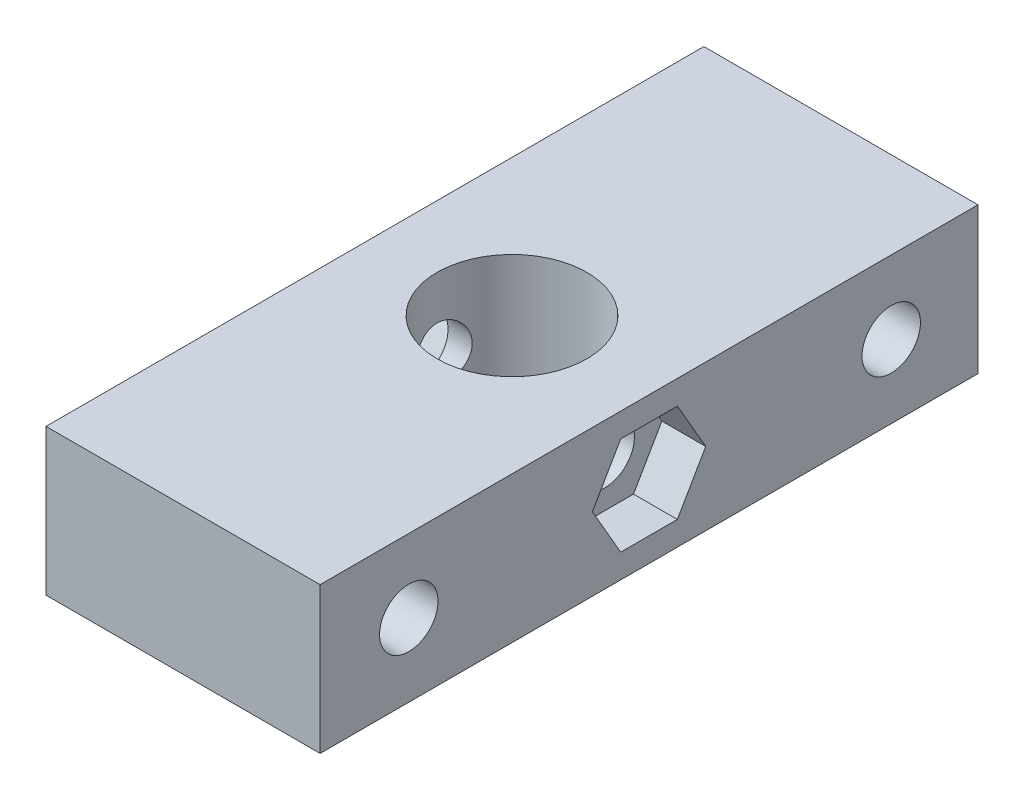
from build123d import *

# Parameters (mm, degrees)
SKETCH2_W                = 15
SKETCH2_H                = 36
BOSS_EXTRUDE1_DEPTH      = 8
SKETCH4_R                = 4.1
CUT_EXTRUDE1_DEPTH       = 22.077238908
CUT_EXTRUDE2_DEPTH       = 2.4
CUT_EXTRUDE5_DEPTH       = 2.4
CUT_EXTRUDE8_DEPTH       = 2.4
CUT_EXTRUDE9_REACH       = 25.383
CUT_EXTRUDE9_END_RADIUS  = 4.1
SKETCH21_R               = 1.6
CUT_EXTRUDE10_REACH      = 25.383
CUT_EXTRUDE10_END_RADIUS = 4.1
SKETCH16_R               = 1.6
SKETCH24_R               = 1.6
CUT_EXTRUDE11_DEPTH      = 24.382899769


with BuildPart() as part:
    # Sketch2 → Boss-Extrude1 (new body)
    with BuildSketch(Plane(origin=(0, 0, 0), x_dir=(1, 0, 0), z_dir=(0, 1, 0))):
        Rectangle(SKETCH2_W, SKETCH2_H)
    extrude(amount=BOSS_EXTRUDE1_DEPTH)

    # Sketch4 → Cut-Extrude1 (cut, through all)
    with BuildSketch(Plane(origin=(0, 8, 0), x_dir=(1, 0, 0), z_dir=(0, 1, 0))):
        with Locations(Location((0, 0, 0), (0, 0, 270))):
            Circle(SKETCH4_R)
    extrude(amount=-CUT_EXTRUDE1_DEPTH, mode=Mode.SUBTRACT)

    # Sketch13 → Cut-Extrude2 (cut)
    with BuildSketch(Plane.ZY.offset(7.5)):
        Polygon((16.3, 4), (14.75, 6.684678752), (11.65, 6.684678752), (10.1, 4), (11.65, 1.315321248), (14.75, 1.315321248), align=None)
        Polygon((-10.1, 4), (-11.65, 6.684678752), (-14.75, 6.684678752), (-16.3, 4), (-14.75, 1.315321248), (-11.65, 1.315321248), align=None)
    extrude(amount=-CUT_EXTRUDE2_DEPTH, mode=Mode.SUBTRACT)

    # Sketch15 → Cut-Extrude5 (cut)
    with BuildSketch(Plane(origin=(7.5, 0, 0), x_dir=(0, 0, -1), z_dir=(1, 0, 0))):
        Polygon((-3.1, 4), (-1.55, 1.315321248), (1.55, 1.315321248), (3.1, 4), (1.55, 6.684678752), (-1.55, 6.684678752), align=None)
    extrude(amount=-CUT_EXTRUDE5_DEPTH, mode=Mode.SUBTRACT)

    # Sketch20 → Cut-Extrude8 (cut)
    with BuildSketch(Plane.ZY.offset(7.5)):
        Polygon((3.1, 4), (1.55, 6.684678752), (-1.55, 6.684678752), (-3.1, 4), (-1.55, 1.315321248), (1.55, 1.315321248), align=None)
    extrude(amount=-CUT_EXTRUDE8_DEPTH, mode=Mode.SUBTRACT)

    # Cut-Extrude9: up to this cylinder (the profile starts outside it)
    cut_extrude9_end = Plane(origin=(0, 4, 0), z_dir=(0, 1, 0)) * Cylinder(CUT_EXTRUDE9_END_RADIUS, 59.966, mode=Mode.PRIVATE)
    # Sketch21 → Cut-Extrude9 (cut, up to the surface)
    with BuildSketch(Plane.ZY.offset(5.1), mode=Mode.PRIVATE) as cut_extrude9_sk1:
        with Locations((0, 4)):
            Circle(SKETCH21_R)
    cut_extrude9_tool1 = extrude(cut_extrude9_sk1.sketch, amount=-CUT_EXTRUDE9_REACH, mode=Mode.PRIVATE) - cut_extrude9_end
    add(cut_extrude9_tool1.solids().sort_by_distance((-5.1, 4, 0))[0], mode=Mode.SUBTRACT)

    # Cut-Extrude10: up to this cylinder (the profile starts outside it)
    cut_extrude10_end = Plane(origin=(0, 4, 0), z_dir=(0, 1, 0)) * Cylinder(CUT_EXTRUDE10_END_RADIUS, 59.966, mode=Mode.PRIVATE)
    # Sketch16 → Cut-Extrude10 (cut, up to the surface)
    with BuildSketch(Plane(origin=(5.1, 0, 0), x_dir=(0, 0, -1), z_dir=(1, 0, 0)), mode=Mode.PRIVATE) as cut_extrude10_sk1:
        with Locations(Location((0, 4, 0), (0, 0, 180))):
            Circle(SKETCH16_R)
    cut_extrude10_tool1 = extrude(cut_extrude10_sk1.sketch, amount=-CUT_EXTRUDE10_REACH, mode=Mode.PRIVATE) - cut_extrude10_end
    add(cut_extrude10_tool1.solids().sort_by_distance((5.1, 4, 0))[0], mode=Mode.SUBTRACT)

    # Sketch24 → Cut-Extrude11 (cut, through all)
    with BuildSketch(Plane.ZY.offset(5.1)):
        with Locations((13.147013408, 4)):
            Circle(SKETCH24_R)
        with Locations((-13.252986592, 4)):
            Circle(SKETCH24_R)
    extrude(amount=-CUT_EXTRUDE11_DEPTH, mode=Mode.SUBTRACT)


solid = part.part
